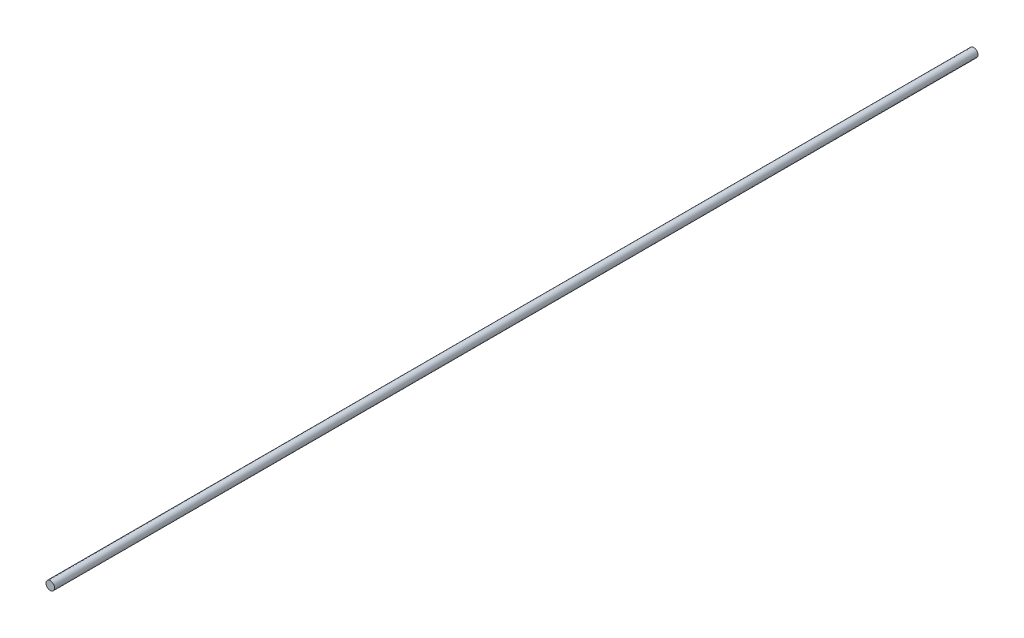
from build123d import *

# Parameters (mm, degrees)
SKETCH1_R           = 3.175
BOSS_EXTRUDE1_DEPTH = 685.8


with BuildPart() as part:
    # Sketch1 → Boss-Extrude1 (new body)
    with BuildSketch(Plane.XY):
        Circle(SKETCH1_R)
    extrude(amount=BOSS_EXTRUDE1_DEPTH)


solid = part.part
